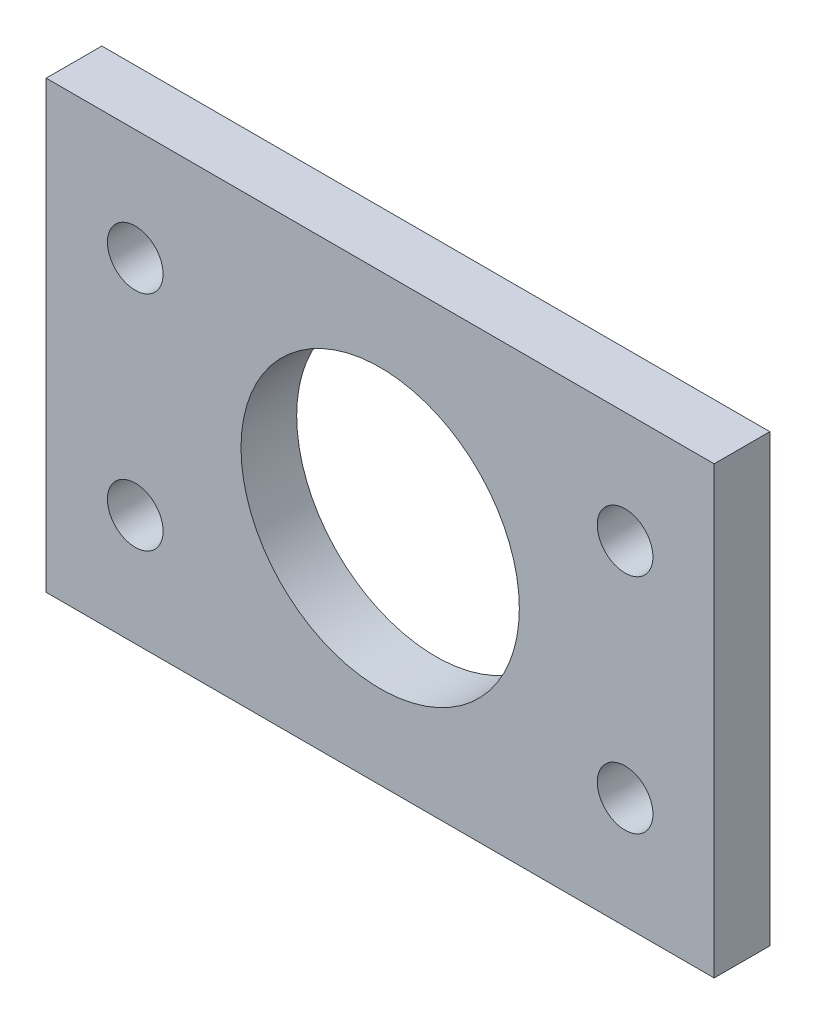
from build123d import *

# Parameters (mm, degrees)
SKETCH1_W           = 60
SKETCH1_H           = 40
BOSS_EXTRUDE1_DEPTH = 5
SKETCH2_R           = 12.5
CUT_EXTRUDE1_DEPTH  = 5
SKETCH3_R           = 2.5
CUT_EXTRUDE2_DEPTH  = 10


with BuildPart() as part:
    # Sketch1 → Boss-Extrude1 (new body)
    with BuildSketch(Plane.XY):
        with Locations((30, 20)):
            Rectangle(SKETCH1_W, SKETCH1_H)
    extrude(amount=BOSS_EXTRUDE1_DEPTH)

    # Sketch2 → Cut-Extrude1 (cut)
    with BuildSketch(Plane.XY.offset(5)):
        with Locations((30, 20)):
            Circle(SKETCH2_R)
    extrude(amount=-CUT_EXTRUDE1_DEPTH, mode=Mode.SUBTRACT)

    # Sketch3 → Cut-Extrude2 (cut)
    with BuildSketch(Plane.XY.offset(5)):
        with Locations((8, 30)):
            Circle(SKETCH3_R)
        with Locations((8, 10)):
            Circle(SKETCH3_R)
        with Locations((52, 10)):
            Circle(SKETCH3_R)
        with Locations((52, 30)):
            Circle(SKETCH3_R)
    extrude(amount=-CUT_EXTRUDE2_DEPTH, mode=Mode.SUBTRACT)


solid = part.part
